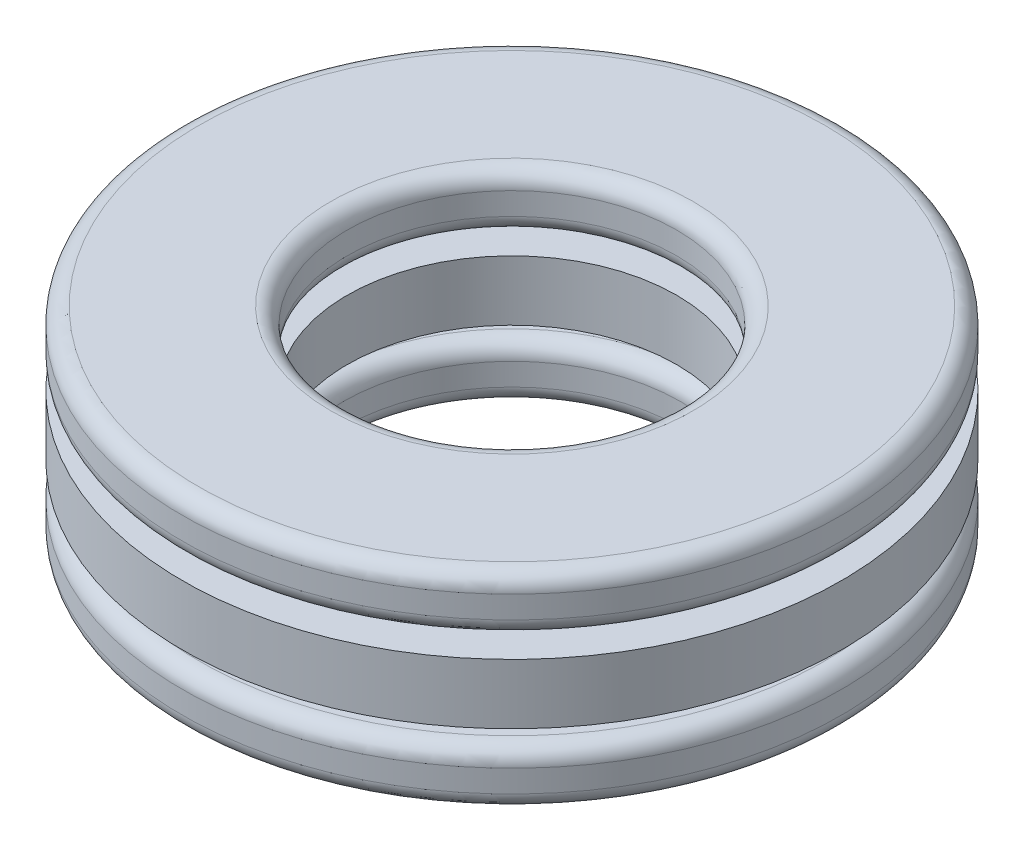
from build123d import *

# Parameters (mm, degrees)
SKETCH1_W         = 4
SKETCH1_H         = 1.458333334
CIRPATTERN1_COUNT = 6
CIRPATTERN1_ANGLE = 300
CIRPATTERN2_COUNT = 6


with BuildPart() as part:
    # Sketch1 → Revolve1 (revolve)
    with BuildSketch(Plane(origin=(0, 0, 0), x_dir=(0, 0, -1), z_dir=(1, 0, 0)), mode=Mode.PRIVATE) as revolve1_sk:
        with Locations((-6, 0)):
            Rectangle(SKETCH1_W, SKETCH1_H)
    revolve(revolve1_sk.sketch.rotate(Axis((0, -3.5, 0), (0, 1, 0)), 180), axis=Axis((0, -3.5, 0), (0, 1, 0)))

    # Sketch3 → Cut-Revolve1 (revolve, cut)
    with BuildSketch(Plane(origin=(0, 0, 0), x_dir=(0, 0, -1), z_dir=(1, 0, 0))):
        with BuildLine():
            Line((-6, 1.166666667), (-6, -1.166666667))
            ThreePointArc((-6, -1.166666667), (-7.166666667, 0), (-6, 1.166666667))
        make_face()
    cut_revolve1 = revolve(axis=Axis((0, 1.166666667, 6), (0, -1, 0)), mode=Mode.SUBTRACT)

    # CirPattern2: Cut-Revolve1 ×6 about axis
    cirpattern2_axis = Axis((0, 0, 0), (0, 1, 0))
    for i in range(1, CIRPATTERN2_COUNT):
        add(cut_revolve1.rotate(cirpattern2_axis, i * 360 / CIRPATTERN2_COUNT), mode=Mode.SUBTRACT)


with BuildPart() as body_2:
    # Sketch2 → Revolve2 (revolve)
    with BuildSketch(Plane(origin=(0, 0, 0), x_dir=(0, 0, -1), z_dir=(1, 0, 0))):
        with BuildLine():
            Line((-6, 1.166666667), (-6, -1.166666667))
            ThreePointArc((-6, -1.166666667), (-7.166666667, 0), (-6, 1.166666667))
        make_face()
    revolve(axis=Axis((0, 1.166666667, 6), (0, -1, 0)))


with BuildPart() as cirpattern1_1:
    # CirPattern1: pattern copy
    add(body_2.part.rotate(Axis((0, 3.5, 0), (0, -1, 0)), 1 * CIRPATTERN1_ANGLE / (CIRPATTERN1_COUNT - 1)))


with BuildPart() as cirpattern1_2:
    # CirPattern1: pattern copy
    add(body_2.part.rotate(Axis((0, 3.5, 0), (0, -1, 0)), 2 * CIRPATTERN1_ANGLE / (CIRPATTERN1_COUNT - 1)))


with BuildPart() as cirpattern1_3:
    # CirPattern1: pattern copy
    add(body_2.part.rotate(Axis((0, 3.5, 0), (0, -1, 0)), 3 * CIRPATTERN1_ANGLE / (CIRPATTERN1_COUNT - 1)))


with BuildPart() as cirpattern1_4:
    # CirPattern1: pattern copy
    add(body_2.part.rotate(Axis((0, 3.5, 0), (0, -1, 0)), 4 * CIRPATTERN1_ANGLE / (CIRPATTERN1_COUNT - 1)))


with BuildPart() as cirpattern1_5:
    # CirPattern1: pattern copy
    add(body_2.part.rotate(Axis((0, 3.5, 0), (0, -1, 0)), 5 * CIRPATTERN1_ANGLE / (CIRPATTERN1_COUNT - 1)))


with BuildPart() as body_8:
    # Sketch4 → Revolve3 (revolve)
    with BuildSketch(Plane(origin=(0, 0, 0), x_dir=(0, 0, -1), z_dir=(1, 0, 0)), mode=Mode.PRIVATE) as revolve3_sk:
        with BuildLine():
            Line((-7.6, 2.5), (-4.4, 2.5))
            ThreePointArc((-4.4, 2.5), (-4.117157288, 2.382842712), (-4, 2.1))
            Line((-4, 2.1), (-4, 1.558333333))
            ThreePointArc((-4, 1.558333333), (-4.117157288, 1.275490621), (-4.4, 1.158333333))
            Line((-4.4, 1.158333333), (-7.6, 1.158333333))
            ThreePointArc((-7.6, 1.158333333), (-7.882842712, 1.275490621), (-8, 1.558333333))
            Line((-8, 1.558333333), (-8, 2.1))
            ThreePointArc((-8, 2.1), (-7.882842712, 2.382842712), (-7.6, 2.5))
        make_face()
        with BuildLine():
            Line((-7.6, -2.5), (-4.5, -2.5))
            ThreePointArc((-4.5, -2.5), (-4.217157288, -2.382842712), (-4.1, -2.1))
            Line((-4.1, -2.1), (-4.1, -1.558333333))
            ThreePointArc((-4.1, -1.558333333), (-4.217157288, -1.275490621), (-4.5, -1.158333333))
            Line((-4.5, -1.158333333), (-7.6, -1.158333333))
            ThreePointArc((-7.6, -1.158333333), (-7.882842712, -1.275490621), (-8, -1.558333333))
            Line((-8, -1.558333333), (-8, -2.1))
            ThreePointArc((-8, -2.1), (-7.882842712, -2.382842712), (-7.6, -2.5))
        make_face()
    revolve(revolve3_sk.sketch.rotate(Axis((0, -3.5, 0), (0, 1, 0)), 180), axis=Axis((0, -3.5, 0), (0, 1, 0)))


solid = Compound([part.part, body_2.part, cirpattern1_1.part, cirpattern1_2.part, cirpattern1_3.part, cirpattern1_4.part, cirpattern1_5.part, body_8.part])
